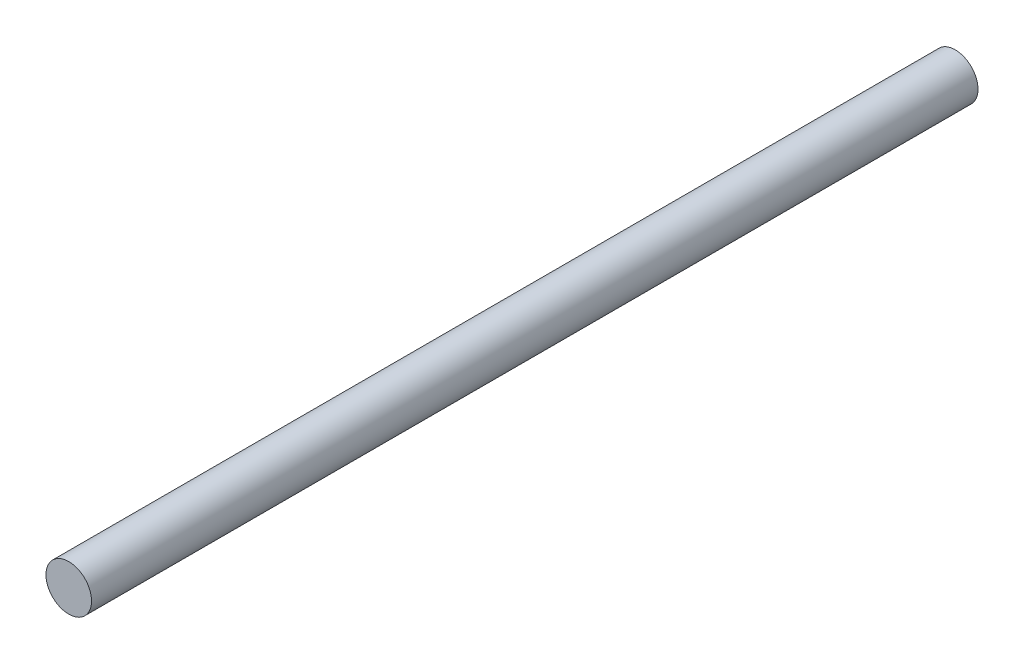
from build123d import *

# Parameters (mm, degrees)
SKETCH1_R           = 2.286
BOSS_EXTRUDE1_DEPTH = 44.45
SCALE1_SCALE        = 1.5


with BuildPart() as part:
    # Sketch1 → Boss-Extrude1 (new, symmetric)
    with BuildSketch(Plane.XY):
        Circle(SKETCH1_R)
    extrude(amount=BOSS_EXTRUDE1_DEPTH, both=True)


with BuildPart() as part_1:
    # Scale1: scaled about (0, 0, 0)
    add(part.part.scale(SCALE1_SCALE))


solid = part_1.part
